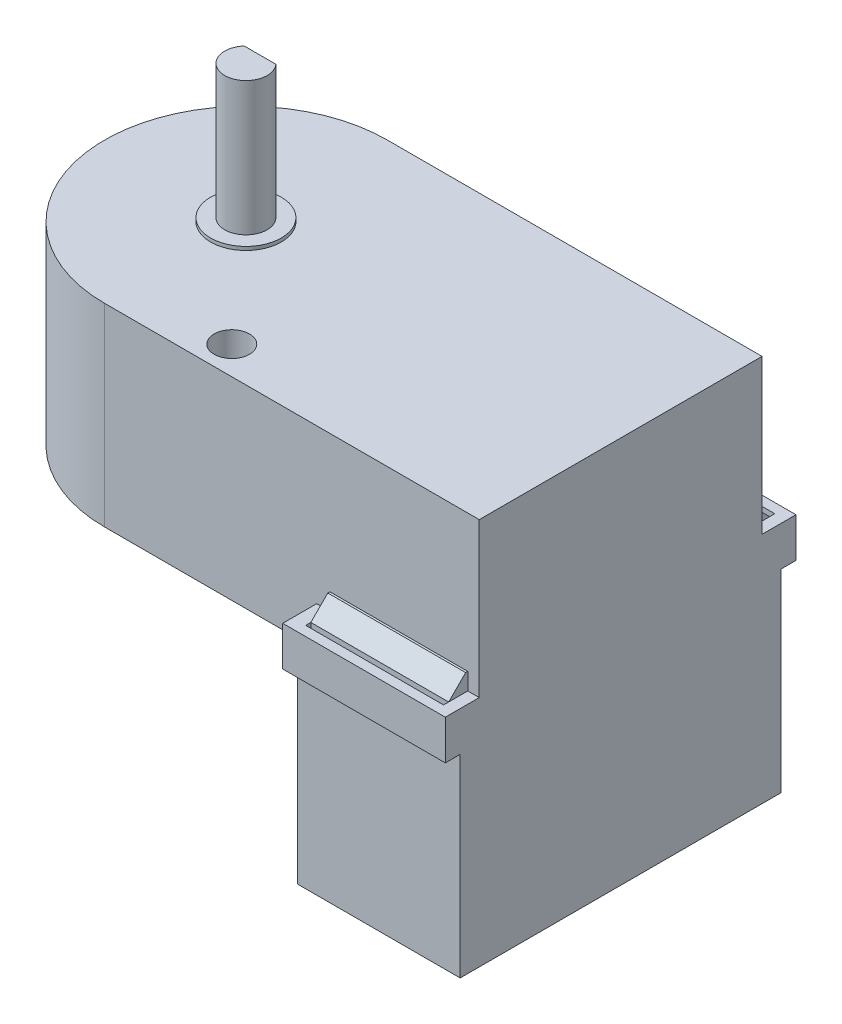
from build123d import *

# Parameters (mm, degrees)
EXTRUDE_1_DEPTH      = 13.7
EXTRUDE_2_DEPTH      = 9.7
SKETCH_3_W           = 11.5
SKETCH_3_H           = 22.7
EXTRUDE_3_DEPTH      = 13.7
SKETCH_4_W           = 11.5
SKETCH_4_H           = 2.8
EXTRUDE_4_DEPTH      = 2.4
SKETCH_5_W           = 11.5
SKETCH_5_H           = 2.8
EXTRUDE_5_DEPTH      = 2.4
SKETCH_6_W           = 9.748758204
SKETCH_6_H           = 1.713624198
CUT_EXTRUDE_7_DEPTH  = 2.8
SKETCH_7_W           = 9.748758204
SKETCH_7_H           = 1.35
EXTRUDE_8_DEPTH      = 4
CHAMFER_1_SIZE       = 1.2
SKETCH_8_R           = 2.5
EXTRUDE_9_DEPTH      = 0.25
SKETCH_9_R           = 1.25
CUT_EXTRUDE_10_DEPTH = 39.014240753


with BuildPart() as part:
    # Эскиз1 → Вытянуть1 (new body)
    with BuildSketch(Plane(origin=(0, 0, 0), x_dir=(1, 0, 0), z_dir=(0, 1, 0))):
        with BuildLine():
            Line((-13.25, 10), (13.25, 10))
            Line((13.25, 10), (13.25, -10))
            Line((13.25, -10), (-13.25, -10))
            ThreePointArc((-13.25, -10), (-23.25, 0), (-13.25, 10))
        make_face()
    extrude(amount=EXTRUDE_1_DEPTH)

    # Эскиз2 → Вытянуть2 (add)
    with BuildSketch(Plane(origin=(0, 13.7, 0), x_dir=(1, 0, 0), z_dir=(0, 1, 0))):
        with BuildLine():
            Line((-14.368033989, 1), (-12.131966011, 1))
            ThreePointArc((-12.131966011, 1), (-13.25, -1.5), (-14.368033989, 1))
        make_face()
    extrude(amount=EXTRUDE_2_DEPTH)

    # Эскиз3 → Вытянуть3 (add)
    with BuildSketch(Plane.XZ):
        with Locations((7.5, 0)):
            Rectangle(SKETCH_3_W, SKETCH_3_H)
    extrude(amount=EXTRUDE_3_DEPTH)

    # Эскиз4 → Вытянуть4 (add)
    with BuildSketch(Plane(origin=(0, 0, -10), x_dir=(-1, 0, 0), z_dir=(0, 0, -1))):
        with Locations((-7.5, 1.4)):
            Rectangle(SKETCH_4_W, SKETCH_4_H)
    extrude(amount=EXTRUDE_4_DEPTH)

    # Эскиз5 → Вытянуть5 (add)
    with BuildSketch(Plane.XY.offset(10)):
        with Locations((7.5, 1.4)):
            Rectangle(SKETCH_5_W, SKETCH_5_H)
    extrude(amount=EXTRUDE_5_DEPTH)

    # Эскиз6 → Вытянуть7 (cut)
    with BuildSketch(Plane(origin=(0, 2.8, 0), x_dir=(1, 0, 0), z_dir=(0, 1, 0))):
        with Locations((7.563806599, 10.856812099)):
            Rectangle(SKETCH_6_W, SKETCH_6_H)
        with Locations((7.563806599, -10.856812099)):
            Rectangle(SKETCH_6_W, SKETCH_6_H)
    extrude(amount=-CUT_EXTRUDE_7_DEPTH, mode=Mode.SUBTRACT)

    # Эскиз7 → Вытянуть8 (add)
    with BuildSketch(Plane(origin=(0, 0, 0), x_dir=(1, 0, 0), z_dir=(0, 1, 0))):
        with Locations((7.563806599, 10.675)):
            Rectangle(SKETCH_7_W, SKETCH_7_H)
        with Locations((7.563806599, -10.675)):
            Rectangle(SKETCH_7_W, SKETCH_7_H)
    extrude(amount=EXTRUDE_8_DEPTH)

    # Фаска1
    chamfer_1_edges = [part.edges().sort_by_distance(p)[0] for p in [
        (7.563806599, 4, -11.35),
        (7.563806599, 4, 11.35),
    ]]
    chamfer(chamfer_1_edges, length=CHAMFER_1_SIZE)

    # Эскиз8 → Вытянуть9 (add)
    with BuildSketch(Plane(origin=(0, 13.7, 0), x_dir=(1, 0, 0), z_dir=(0, 1, 0))):
        with Locations(Location((-13.25, 0, 0), (0, 0, 90))):
            Circle(SKETCH_8_R)
    extrude(amount=EXTRUDE_9_DEPTH)

    # Эскиз9 → Вытянуть10 (cut, through all)
    with BuildSketch(Plane(origin=(0, 13.7, 0), x_dir=(1, 0, 0), z_dir=(0, 1, 0))):
        with Locations(Location((-6.25, -8, 0), (0, 0, 270))):
            Circle(SKETCH_9_R)
    extrude(amount=-CUT_EXTRUDE_10_DEPTH, mode=Mode.SUBTRACT)


solid = part.part
